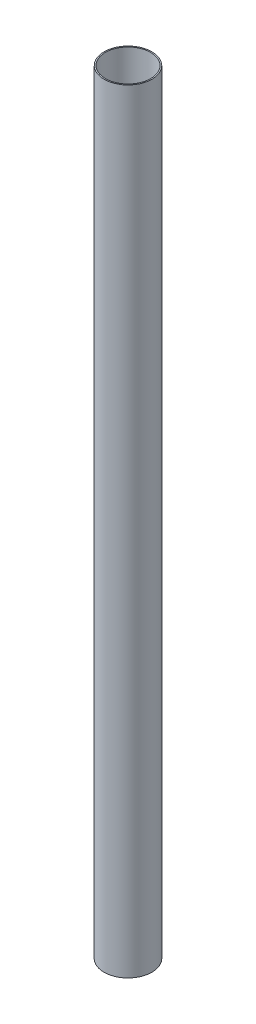
from build123d import *

# Parameters (mm, degrees)
SKETCH1_R           = 15.875
BOSS_EXTRUDE1_DEPTH = 514
SKETCH2_R           = 15.075
CUT_EXTRUDE1_DEPTH  = 515.490069146


with BuildPart() as part:
    # Sketch1 → Boss-Extrude1 (new body)
    with BuildSketch(Plane(origin=(0, 0, 0), x_dir=(1, 0, 0), z_dir=(0, 1, 0))):
        with Locations(Location((0, 0, 0), (0, 0, 270))):
            Circle(SKETCH1_R)
    extrude(amount=BOSS_EXTRUDE1_DEPTH)

    # Sketch2 → Cut-Extrude1 (cut, through all)
    with BuildSketch(Plane.XZ):
        with Locations(Location((0, 0, 0), (0, 0, 270))):
            Circle(SKETCH2_R)
    extrude(amount=-CUT_EXTRUDE1_DEPTH, mode=Mode.SUBTRACT)


solid = part.part
